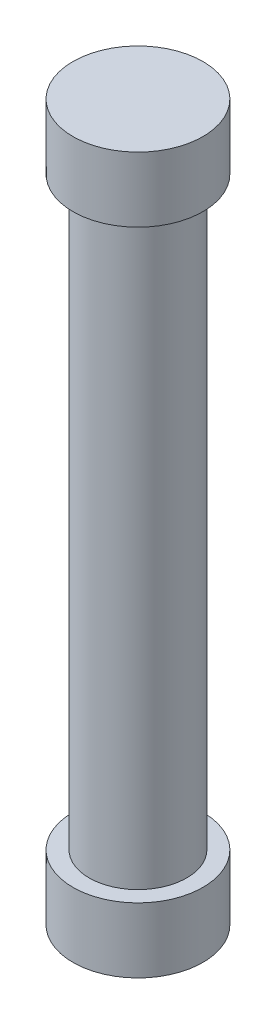
from build123d import *


with BuildPart() as part:
    # Sketch1 → Revolve1 (revolve)
    with BuildSketch(Plane.XY):
        Polygon((0, 3.962755567), (0, -18.037244433), (-2, -18.037244433), (-2, -16.037244433), (-1.5, -16.037244433), (-1.5, 1.962755567), (-2, 1.962755567), (-2, 3.962755567), align=None)
    revolve(axis=Axis((0, 3.962755567, 0), (0, -1, 0)))


solid = part.part
